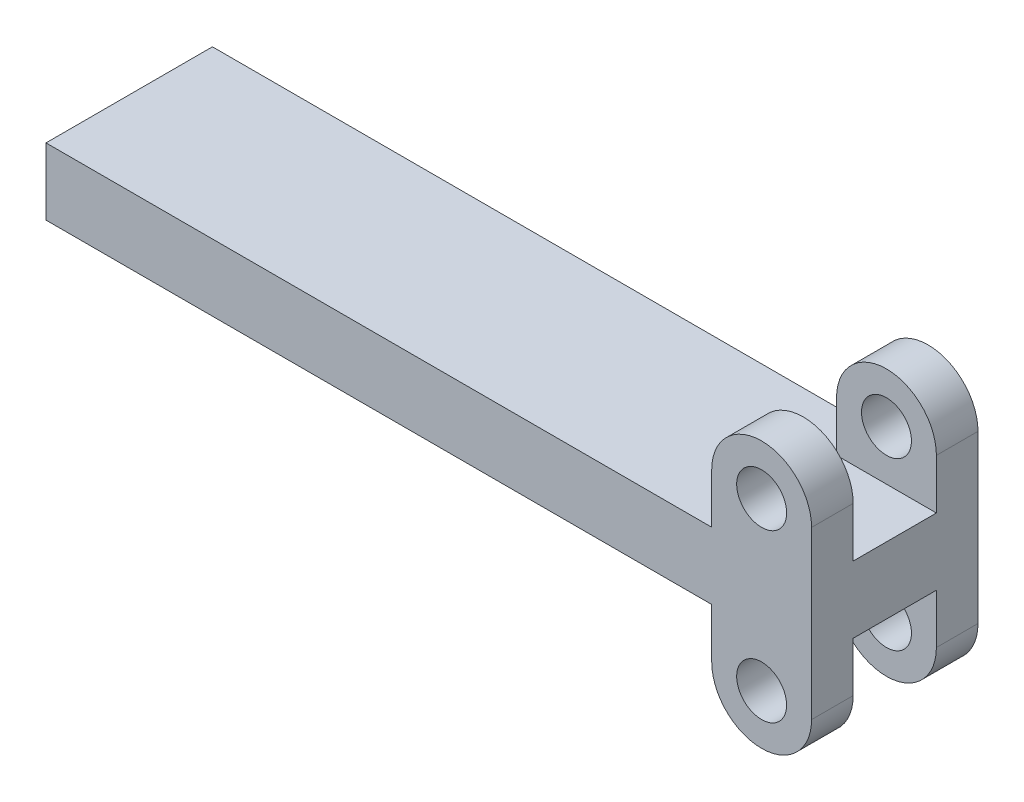
from build123d import *

# Parameters (mm, degrees)
IZIM1_R                     = 1.5
Y_KSEKLIK_EKSTR_ZYON1_DEPTH = 5
KES_EKSTR_ZYON1_DEPTH       = 2.5
IZIM3_W                     = 40
IZIM3_H                     = 4.02
Y_KSEKLIK_EKSTR_ZYON7_DEPTH = 5


with BuildPart() as part:
    # Çizim1 → Yükseklik-Ekstrüzyon1 (new, symmetric)
    with BuildSketch(Plane.XY):
        with BuildLine():
            Line((-3, -1.02611879), (-3, -11.02611879))
            ThreePointArc((-3, -11.02611879), (0, -14.02611879), (3, -11.02611879))
            Line((3, -11.02611879), (3, -1.02611879))
            ThreePointArc((3, -1.02611879), (0, 1.97388121), (-3, -1.02611879))
        make_face()
        with Locations((0, -1.02611879)):
            Circle(IZIM1_R, mode=Mode.SUBTRACT)
        with Locations((0, -11.02611879)):
            Circle(IZIM1_R, mode=Mode.SUBTRACT)
    extrude(amount=Y_KSEKLIK_EKSTR_ZYON1_DEPTH, both=True)

    # Çizim2 → Kes-Ekstrüzyon1 (cut, symmetric)
    with BuildSketch(Plane.XY):
        with BuildLine():
            Line((-3, -1.02611879), (-3, -4.02611879))
            Line((-3, -4.02611879), (0, -4.02611879))
            Line((0, -4.02611879), (3, -4.02611879))
            Line((3, -4.02611879), (3, -1.02611879))
            ThreePointArc((3, -1.02611879), (0, 1.97388121), (-3, -1.02611879))
        make_face()
        with BuildLine():
            ThreePointArc((-3, -11.02611879), (0, -14.02611879), (3, -11.02611879))
            Line((3, -11.02611879), (3, -8.043702706))
            Line((3, -8.043702706), (-3, -8.043702706))
            Line((-3, -8.043702706), (-3, -11.02611879))
        make_face()
    extrude(amount=KES_EKSTR_ZYON1_DEPTH, both=True, mode=Mode.SUBTRACT)

    # Çizim3 → Yükseklik-Ekstrüzyon7 (add, symmetric)
    with BuildSketch(Plane.XY):
        with Locations((-23, -6.02611879)):
            Rectangle(IZIM3_W, IZIM3_H)
    extrude(amount=Y_KSEKLIK_EKSTR_ZYON7_DEPTH, both=True)


solid = part.part
